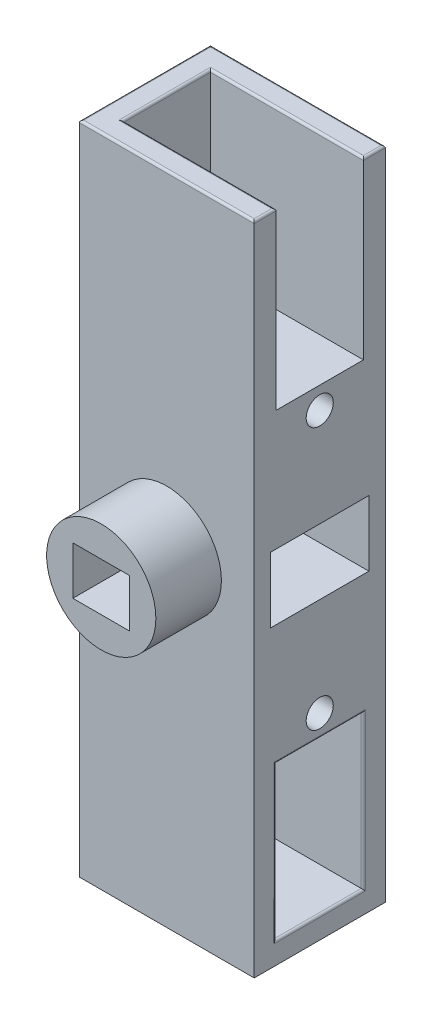
from build123d import *

# Parameters (mm, degrees)
BOSS_EXTRUDE1_DEPTH      = 75
BOSS_EXTRUDE1_DEPTH_BACK = 75
SKETCH1_W                = 40
SKETCH1_H                = 30
SKETCH3_R                = 3.1
CUT_EXTRUDE1_DEPTH       = 150
CUT_EXTRUDE2_DEPTH       = 150
CUT_EXTRUDE2_DEPTH_BACK  = 150
SKETCH4_W                = 22.5
SKETCH4_H                = 15
SKETCH5_R                = 7.6
CUT_EXTRUDE3_DEPTH       = 16
SKETCH7_W                = 58.590655802
SKETCH7_H                = 20
CUT_EXTRUDE5_DEPTH       = 40
SKETCH8_W                = 20
SKETCH8_H                = 35
CUT_EXTRUDE6_DEPTH       = 35
FILLET2_R                = 0.5
FILLET3_R                = 0.5
SKETCH10_R               = 12.5
BOSS_EXTRUDE3_DEPTH      = 15
SKETCH11_W               = 13
SKETCH11_H               = 11
CUT_EXTRUDE7_DEPTH       = 25


with BuildPart() as part:
    # Sketch1 → Boss-Extrude1 (new, two sides: drawn at the far end of the back side and taken through both)
    with BuildSketch(Plane(origin=(0, 0, 0), x_dir=(1, 0, 0), z_dir=(0, 1, 0)).offset(-BOSS_EXTRUDE1_DEPTH_BACK)):
        Rectangle(SKETCH1_W, SKETCH1_H)
    extrude(amount=BOSS_EXTRUDE1_DEPTH + BOSS_EXTRUDE1_DEPTH_BACK)

    # Sketch3 → Cut-Extrude1 (cut)
    with BuildSketch(Plane(origin=(20, 0, 0), x_dir=(0, 0, -1), z_dir=(1, 0, 0))):
        with Locations((0, 30)):
            Circle(SKETCH3_R)
    cut_extrude1 = extrude(amount=-CUT_EXTRUDE1_DEPTH, mode=Mode.SUBTRACT)

    # Mirror1: Cut-Extrude1 across plane
    add(cut_extrude1.mirror(Plane.ZX), mode=Mode.SUBTRACT)

    # Sketch4 → Cut-Extrude2 (cut, two sides: drawn at the far end of the back side and taken through both)
    with BuildSketch(Plane(origin=(0, 0, 0), x_dir=(0, 0, -1), z_dir=(1, 0, 0)).offset(-CUT_EXTRUDE2_DEPTH_BACK)):
        Rectangle(SKETCH4_W, SKETCH4_H)
    extrude(amount=CUT_EXTRUDE2_DEPTH + CUT_EXTRUDE2_DEPTH_BACK, mode=Mode.SUBTRACT)

    # Sketch5 → Cut-Extrude3 (cut)
    with BuildSketch(Plane(origin=(0, 0, -15), x_dir=(-1, 0, 0), z_dir=(0, 0, -1))):
        Circle(SKETCH5_R)
    extrude(amount=-CUT_EXTRUDE3_DEPTH, mode=Mode.SUBTRACT)

    # Sketch7 → Cut-Extrude5 (cut)
    with BuildSketch(Plane(origin=(0, 75, 0), x_dir=(1, 0, 0), z_dir=(0, 1, 0))):
        with Locations((14.295327901, 0)):
            Rectangle(SKETCH7_W, SKETCH7_H)
    extrude(amount=-CUT_EXTRUDE5_DEPTH, mode=Mode.SUBTRACT)

    # Sketch8 → Cut-Extrude6 (cut)
    with BuildSketch(Plane(origin=(20, 0, 0), x_dir=(0, 0, -1), z_dir=(1, 0, 0))):
        with Locations((0, -52.5)):
            Rectangle(SKETCH8_W, SKETCH8_H)
    extrude(amount=-CUT_EXTRUDE6_DEPTH, mode=Mode.SUBTRACT)

    # Fillet2
    fillet2_edges = [part.edges().sort_by_distance(p)[0] for p in [
        (20, 75, -12.5),
        (2.5, 75, -10),
        (-15, 75, 0),
        (2.5, 75, 10),
        (20, 75, 12.5),
        (0, 75, -15),
        (-20, 75, 0),
        (0, 75, 15),
    ]]
    fillet(fillet2_edges, radius=FILLET2_R)

    # Fillet3
    fillet3_edges = [part.edges().sort_by_distance(p)[0] for p in [
        (20, -70, 0),
        (20, -52.5, 10),
        (20, -35, 0),
        (20, -52.5, -10),
    ]]
    fillet(fillet3_edges, radius=FILLET3_R)

    # Sketch10 → Boss-Extrude3 (add)
    with BuildSketch(Plane.XY.offset(15)):
        Circle(SKETCH10_R)
    extrude(amount=BOSS_EXTRUDE3_DEPTH)

    # Sketch11 → Cut-Extrude7 (cut)
    with BuildSketch(Plane.XY.offset(30)):
        Rectangle(SKETCH11_W, SKETCH11_H)
    extrude(amount=-CUT_EXTRUDE7_DEPTH, mode=Mode.SUBTRACT)


solid = part.part
